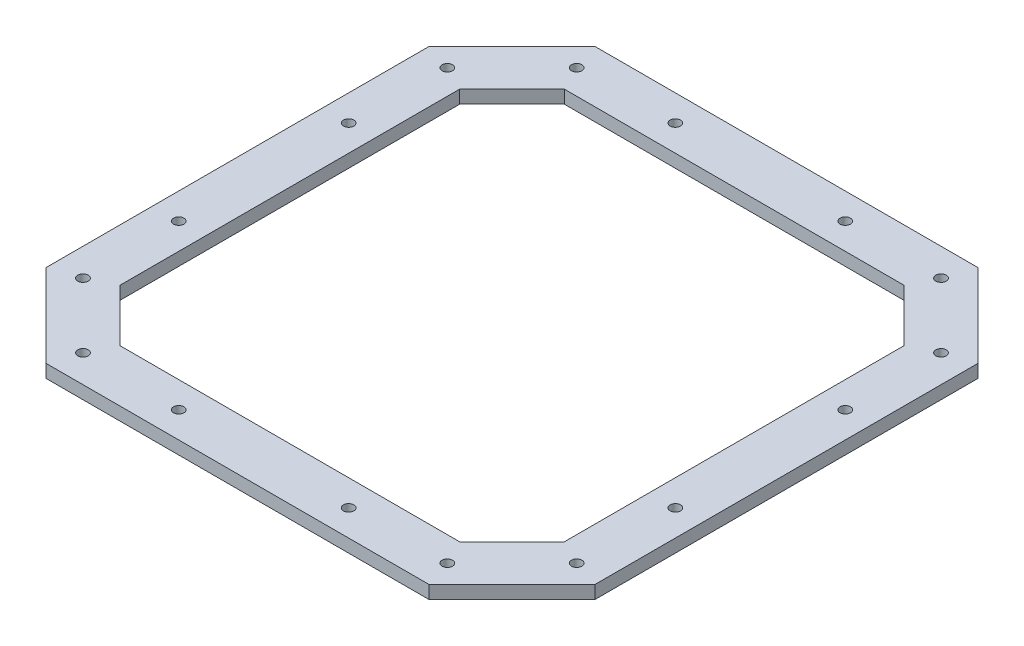
from build123d import *

# Parameters (mm, degrees)
SKETCH1_R           = 2
BOSS_EXTRUDE1_DEPTH = 5


with BuildPart() as part:
    # Sketch1 → Boss-Extrude1 (new body)
    with BuildSketch(Plane(origin=(0, 0, 0), x_dir=(1, 0, 0), z_dir=(0, 1, 0))):
        Polygon((105, -73.284271247), (105, 73.284271247), (73.284271247, 105), (-73.284271247, 105), (-105, 73.284271247), (-105, -73.284271247), (-73.284271247, -105), (73.284271247, -105), align=None)
        with Locations(Location((-95, 32.5, 0), (0, 0, 270))):
            Circle(SKETCH1_R, mode=Mode.SUBTRACT)
        with Locations(Location((-95, -32.5, 0), (0, 0, 90))):
            Circle(SKETCH1_R, mode=Mode.SUBTRACT)
        with Locations(Location((32.5, 95, 0), (0, 0, 270))):
            Circle(SKETCH1_R, mode=Mode.SUBTRACT)
        with Locations(Location((-32.5, 95, 0), (0, 0, 90))):
            Circle(SKETCH1_R, mode=Mode.SUBTRACT)
        with Locations(Location((-32.5, -95, 0), (0, 0, 270))):
            Circle(SKETCH1_R, mode=Mode.SUBTRACT)
        with Locations(Location((32.5, -95, 0), (0, 0, 90))):
            Circle(SKETCH1_R, mode=Mode.SUBTRACT)
        with Locations(Location((95, -32.5, 0), (0, 0, 270))):
            Circle(SKETCH1_R, mode=Mode.SUBTRACT)
        with Locations(Location((95, 32.5, 0), (0, 0, 90))):
            Circle(SKETCH1_R, mode=Mode.SUBTRACT)
        with Locations(Location((-94.445436483, -69.696699141, 0), (0, 0, 270))):
            Circle(SKETCH1_R, mode=Mode.SUBTRACT)
        with Locations(Location((-69.696699141, -94.445436483, 0), (0, 0, 90))):
            Circle(SKETCH1_R, mode=Mode.SUBTRACT)
        with Locations(Location((69.696699141, -94.445436483, 0), (0, 0, 270))):
            Circle(SKETCH1_R, mode=Mode.SUBTRACT)
        with Locations(Location((94.445436483, -69.696699141, 0), (0, 0, 90))):
            Circle(SKETCH1_R, mode=Mode.SUBTRACT)
        with Locations(Location((-94.445436483, 69.696699141, 0), (0, 0, 90))):
            Circle(SKETCH1_R, mode=Mode.SUBTRACT)
        with Locations(Location((-69.696699141, 94.445436483, 0), (0, 0, 270))):
            Circle(SKETCH1_R, mode=Mode.SUBTRACT)
        with Locations(Location((69.696699141, 94.445436483, 0), (0, 0, 90))):
            Circle(SKETCH1_R, mode=Mode.SUBTRACT)
        with Locations(Location((94.445436483, 69.696699141, 0), (0, 0, 270))):
            Circle(SKETCH1_R, mode=Mode.SUBTRACT)
        Polygon((65, 85), (85, 65), (85, -65), (65, -85), (-65, -85), (-85, -65), (-85, 65), (-65, 85), align=None, mode=Mode.SUBTRACT)
    extrude(amount=BOSS_EXTRUDE1_DEPTH)


solid = part.part
